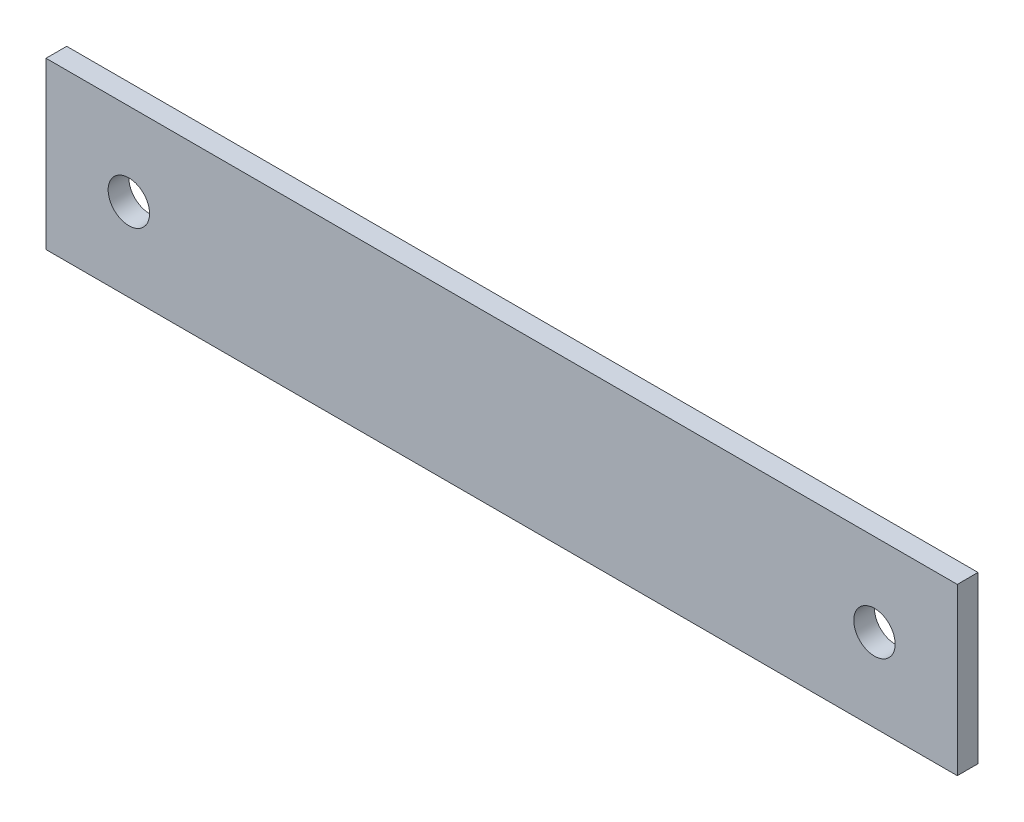
from build123d import *

# Parameters (mm, degrees)
SKETCH1_W           = 139.7
SKETCH1_H           = 25.4
SKETCH1_R           = 3.175
BOSS_EXTRUDE1_DEPTH = 3.175


with BuildPart() as part:
    # Sketch1 → Boss-Extrude1 (new body)
    with BuildSketch(Plane.XY):
        with Locations((69.85, 12.7)):
            Rectangle(SKETCH1_W, SKETCH1_H)
        with Locations((12.7, 12.7)):
            Circle(SKETCH1_R, mode=Mode.SUBTRACT)
        with Locations((127, 12.7)):
            Circle(SKETCH1_R, mode=Mode.SUBTRACT)
    extrude(amount=BOSS_EXTRUDE1_DEPTH)


solid = part.part
